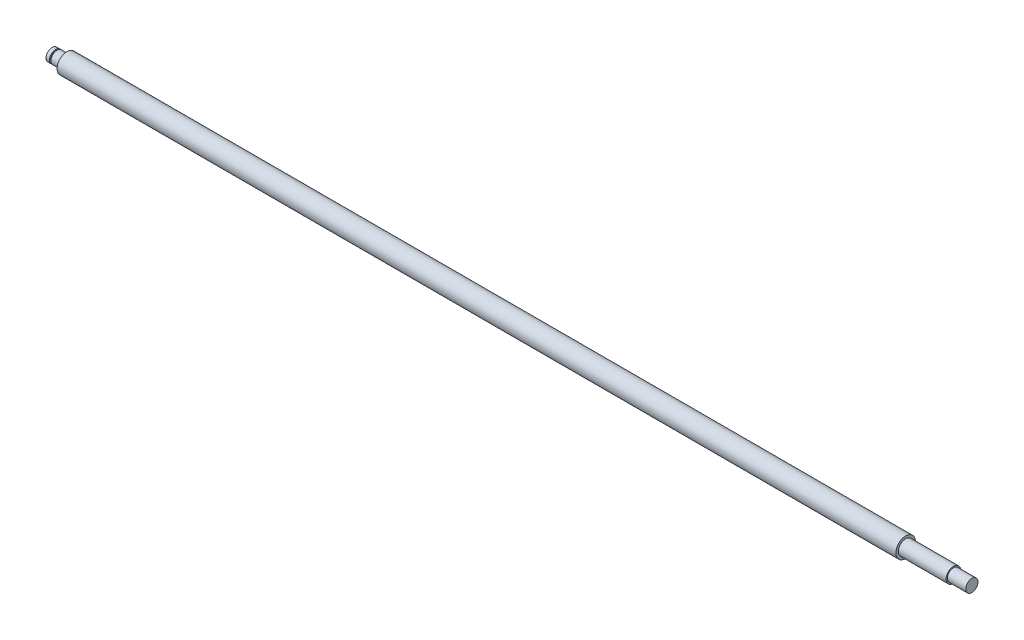
from build123d import *


with BuildPart() as part:
    # Esquisse1 → Révolution1 (revolve)
    with BuildSketch(Plane.XY, mode=Mode.PRIVATE) as r_volution1_sk:
        Polygon((-88.223286033, 0), (-88.223286033, 5), (-85.369889122, 5), (-85.369889122, 4), (-84.219889122, 4), (-84.219889122, 5), (-76.219889122, 5), (-76.219889122, 8), (607.780110878, 8), (607.780110878, 6), (634.780110878, 6), (646.780110878, 6), (646.780110878, 5), (661.780110878, 5), (661.780110878, 0), align=None)
    revolve(r_volution1_sk.sketch.rotate(Axis((-89.400555638, 0, 0), (1, 0, 0)), 90), axis=Axis((-89.400555638, 0, 0), (1, 0, 0)))


solid = part.part
